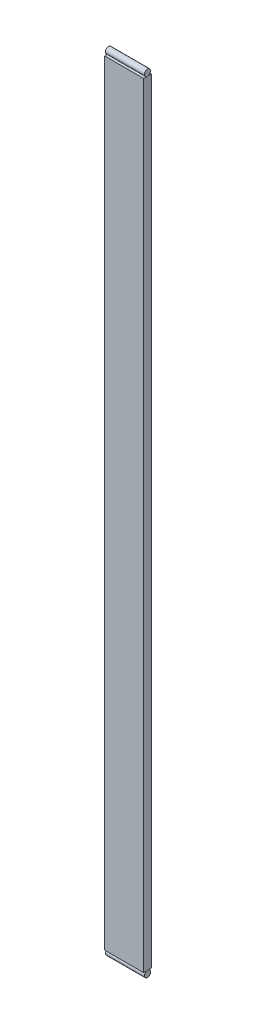
from build123d import *

# Parameters (mm, degrees)
SKETCH1_W             = 50
SKETCH1_H             = 10
BOSS_EXTRUDE1_DEPTH   = 992
SKETCH2_R             = 4
BOSS_EXTRUDE2_DEPTH   = 50
BOSS_EXTRUDE2_2_DEPTH = 50


with BuildPart() as part:
    # Sketch1 → Boss-Extrude1 (new body)
    with BuildSketch(Plane(origin=(0, 0, 0), x_dir=(1, 0, 0), z_dir=(0, 1, 0))):
        Rectangle(SKETCH1_W, SKETCH1_H)
    extrude(amount=BOSS_EXTRUDE1_DEPTH)


with BuildPart() as body_2:
    # Sketch2 → Boss-Extrude2 (new body)
    with BuildSketch(Plane(origin=(25, 0, 0), x_dir=(0, 0, -1), z_dir=(1, 0, 0))):
        with Locations((0, 996)):
            Circle(SKETCH2_R)
    extrude(amount=-BOSS_EXTRUDE2_DEPTH)


with BuildPart() as body_3:
    # Sketch2 → Boss-Extrude2 2 (new body)
    with BuildSketch(Plane(origin=(25, 0, 0), x_dir=(0, 0, -1), z_dir=(1, 0, 0))):
        with Locations((0, -4)):
            Circle(SKETCH2_R)
    extrude(amount=-BOSS_EXTRUDE2_2_DEPTH)


solid = Compound([part.part, body_2.part, body_3.part])
